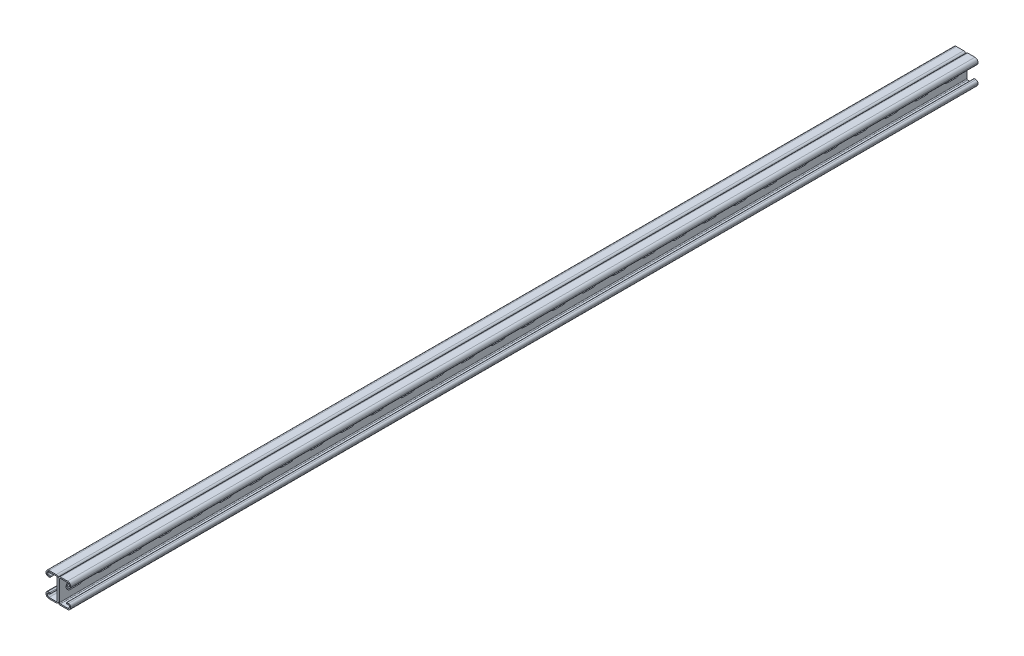
from build123d import *

# Parameters (mm, degrees)
BOSS_EXTRUDE1_DEPTH = 1524
CUT_EXTRUDE1_DEPTH  = 2.032
LPATTERN1_COUNT     = 30
LPATTERN1_PITCH     = 50.8


with BuildPart() as part:
    # Sketch1 → Boss-Extrude1 (new body)
    with BuildSketch(Plane.XY):
        with BuildLine():
            Line((-15.58925, 20.6375), (-3.46075, 20.6375))
            ThreePointArc((-3.46075, 20.6375), (-1.013630207, 19.623869793), (0, 17.17675))
            Line((0, 17.17675), (0, -17.17675))
            ThreePointArc((0, -17.17675), (-1.013630207, -19.623869793), (-3.46075, -20.6375))
            Line((-3.46075, -20.6375), (-15.58925, -20.6375))
            ThreePointArc((-15.58925, -20.6375), (-19.158901808, -19.158901808), (-20.6375, -15.58925))
            Line((-20.6375, -15.58925), (-20.6375, -14.57325))
            ThreePointArc((-20.6375, -14.57325), (-19.623869793, -12.126130207), (-17.17675, -11.1125))
            Line((-17.17675, -11.1125), (-14.5161, -11.1125))
            ThreePointArc((-14.5161, -11.1125), (-13.5001, -12.1285), (-14.5161, -13.1445))
            Line((-14.5161, -13.1445), (-17.17675, -13.1445))
            ThreePointArc((-17.17675, -13.1445), (-18.187028814, -13.562971186), (-18.6055, -14.57325))
            Line((-18.6055, -14.57325), (-18.6055, -15.58925))
            ThreePointArc((-18.6055, -15.58925), (-17.722060829, -17.722060829), (-15.58925, -18.6055))
            Line((-15.58925, -18.6055), (-3.46075, -18.6055))
            ThreePointArc((-3.46075, -18.6055), (-2.450471186, -18.187028814), (-2.032, -17.17675))
            Line((-2.032, -17.17675), (-2.032, 17.17675))
            ThreePointArc((-2.032, 17.17675), (-2.450471186, 18.187028814), (-3.46075, 18.6055))
            Line((-3.46075, 18.6055), (-15.58925, 18.6055))
            ThreePointArc((-15.58925, 18.6055), (-17.722060829, 17.722060829), (-18.6055, 15.58925))
            Line((-18.6055, 15.58925), (-18.6055, 14.57325))
            ThreePointArc((-18.6055, 14.57325), (-18.187028814, 13.562971186), (-17.17675, 13.1445))
            Line((-17.17675, 13.1445), (-14.5161, 13.1445))
            ThreePointArc((-14.5161, 13.1445), (-13.5001, 12.1285), (-14.5161, 11.1125))
            Line((-14.5161, 11.1125), (-17.17675, 11.1125))
            ThreePointArc((-17.17675, 11.1125), (-19.623869793, 12.126130207), (-20.6375, 14.57325))
            Line((-20.6375, 14.57325), (-20.6375, 15.58925))
            ThreePointArc((-20.6375, 15.58925), (-19.158901808, 19.158901808), (-15.58925, 20.6375))
        make_face()
    extrude(amount=-BOSS_EXTRUDE1_DEPTH)

    # Sketch2 → Cut-Extrude1 (cut)
    with BuildSketch(Plane(origin=(0, 0, 0), x_dir=(0, 0, -1), z_dir=(1, 0, 0))):
        with BuildLine():
            Line((18.25625, 7.14375), (32.54375, 7.14375))
            ThreePointArc((32.54375, 7.14375), (39.6875, 0), (32.54375, -7.14375))
            Line((32.54375, -7.14375), (18.25625, -7.14375))
            ThreePointArc((18.25625, -7.14375), (11.1125, 0), (18.25625, 7.14375))
        make_face()
    cut_extrude1 = extrude(amount=-CUT_EXTRUDE1_DEPTH, mode=Mode.SUBTRACT)

    # LPattern1: Cut-Extrude1 ×30
    with Locations(*[(0, 0, -i * LPATTERN1_PITCH) for i in range(1, LPATTERN1_COUNT)]):
        add(cut_extrude1, mode=Mode.SUBTRACT)


with BuildPart() as body_2:
    # Mirror1: mirrored copy
    add(part.part.mirror(Plane(origin=(0, 17.17675, -1524), x_dir=(0, 0, 1), z_dir=(1, 0, 0))))


solid = Compound([part.part, body_2.part])
